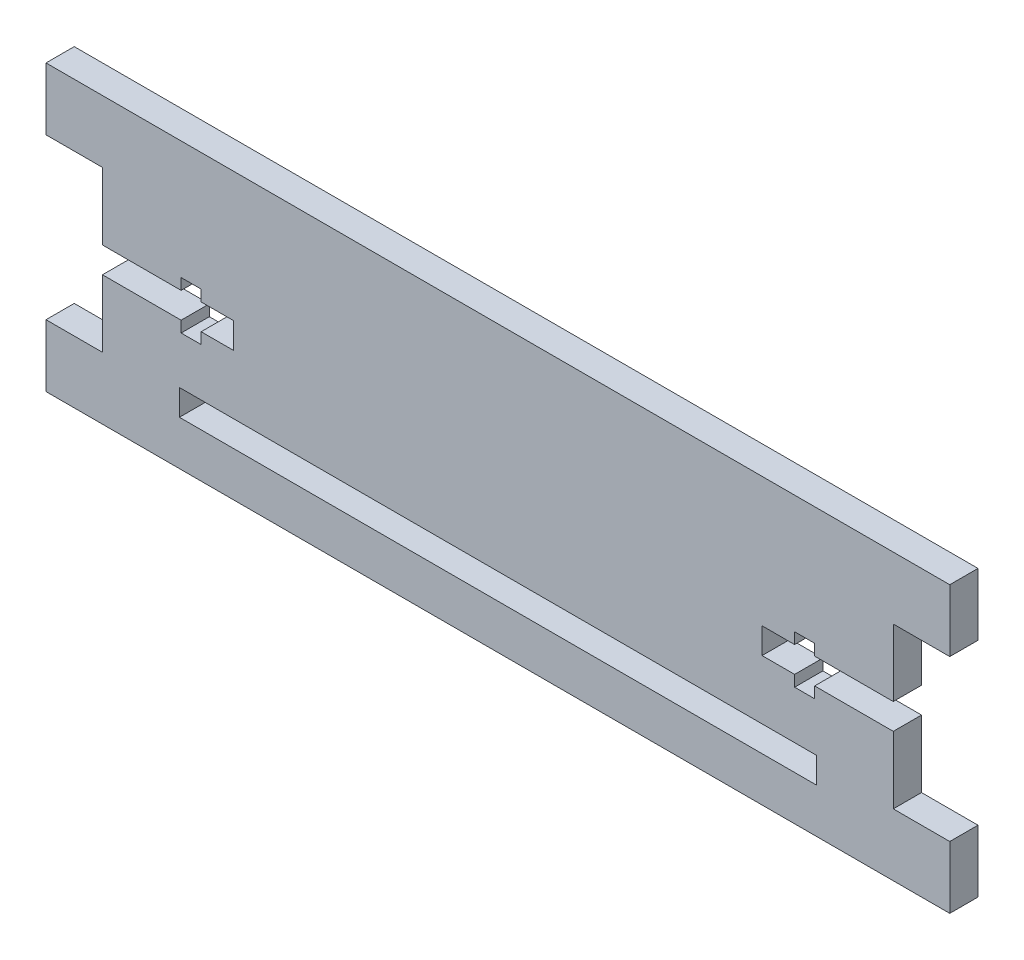
from build123d import *

# Parameters (mm, degrees)
SKETCH1_W      = 71.6
SKETCH1_H      = 2.9
EXTRUDE1_DEPTH = 3.175


with BuildPart() as part:
    # Sketch1 → Extrude1 (new body)
    with BuildSketch(Plane.XY):
        Polygon((90.427144536, 6.036016451), (90.427144536, 13.036016451), (84.077144536, 13.036016451), (84.077144536, 20.586016451), (75.237144536, 20.586016451), (75.237144536, 19.336016451), (72.987144536, 19.336016451), (72.987144536, 20.586016451), (69.327144536, 20.586016451), (69.327144536, 23.486016451), (72.987144536, 23.486016451), (72.987144536, 24.736016451), (75.237144536, 24.736016451), (75.237144536, 23.486016451), (84.077144536, 23.486016451), (84.077144536, 31.036016451), (90.427144536, 31.036016451), (90.427144536, 38.036016451), (-11.172855464, 38.036016451), (-11.172855464, 31.036016451), (-4.822855464, 31.036016451), (-4.822855464, 23.486016451), (4.017144536, 23.486016451), (4.017144536, 24.736016451), (6.267144536, 24.736016451), (6.267144536, 23.486016451), (9.927144536, 23.486016451), (9.927144536, 20.586016451), (6.267144536, 20.586016451), (6.267144536, 19.336016451), (4.017144536, 19.336016451), (4.017144536, 20.586016451), (-4.822855464, 20.586016451), (-4.822855464, 13.036016451), (-11.172855464, 13.036016451), (-11.172855464, 6.036016451), align=None)
        with Locations((39.627144536, 12.486016451)):
            Rectangle(SKETCH1_W, SKETCH1_H, mode=Mode.SUBTRACT)
    extrude(amount=EXTRUDE1_DEPTH)


solid = part.part
